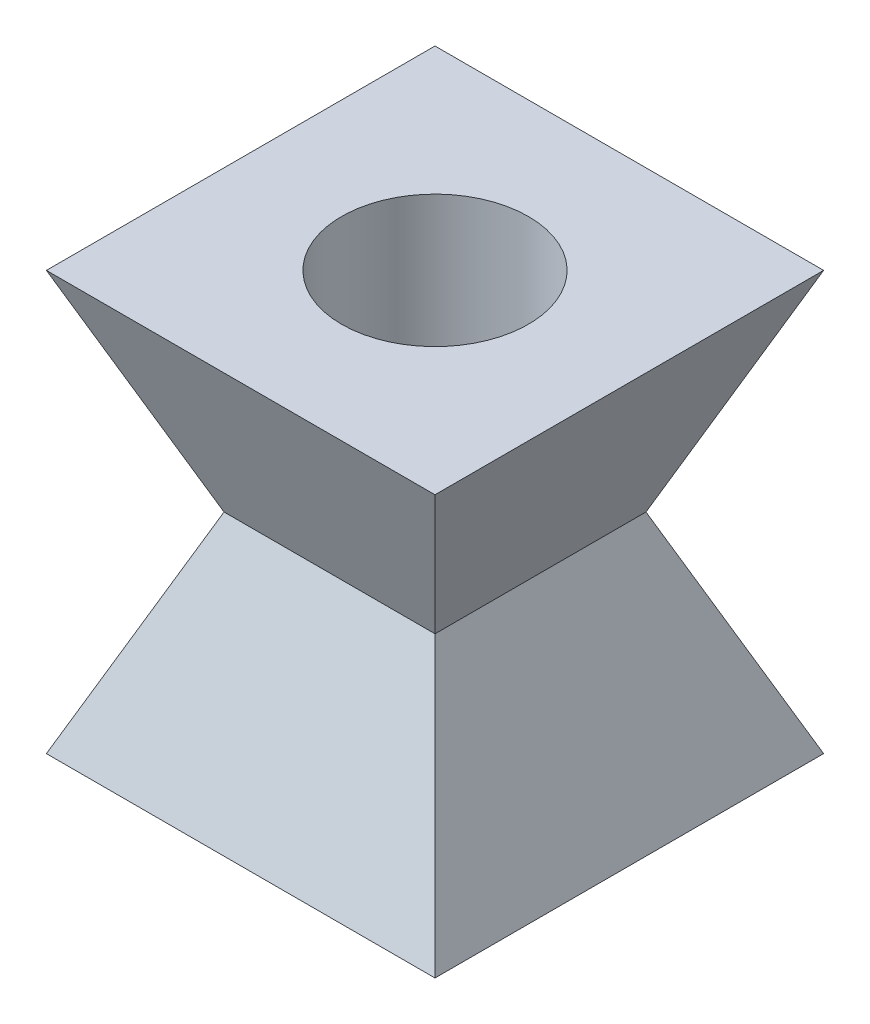
from build123d import *

# Parameters (mm, degrees)
BOSS_EXTRU_2_DEPTH           = 52
ESQUISSE3_R                  = 25
ENL_V_MAT_EXTRU_1_DEPTH      = 134.985073796
ENL_V_MAT_EXTRU_2_DEPTH      = 93.433760066
ENL_V_MAT_EXTRU_2_DEPTH_BACK = 93.433760066


with BuildPart() as part:
    # Esquisse2 → Boss.-Extru.2 (new, symmetric)
    with BuildSketch(Plane.XY):
        Polygon((28.229410292, 0), (52, -56), (-52, -56), (-28.229410292, 0), align=None)
        Polygon((-28.229410292, 0), (-52, 56), (52, 56), (28.229410292, 0), align=None)
    extrude(amount=BOSS_EXTRU_2_DEPTH, both=True)

    # Esquisse3 → Enlèv. mat.-Extru.1 (cut, through all)
    with BuildSketch(Plane(origin=(0, 56, 0), x_dir=(1, 0, 0), z_dir=(0, 1, 0))):
        with Locations(Location((0, 0, 0), (0, 0, 270))):
            Circle(ESQUISSE3_R)
    extrude(amount=-ENL_V_MAT_EXTRU_1_DEPTH, mode=Mode.SUBTRACT)

    # Esquisse4 → Enlèv. mat.-Extru.2 (cut, two sides: drawn at the far end of the back side and taken through both)
    with BuildSketch(Plane(origin=(0, 0, 0), x_dir=(0, 0, -1), z_dir=(1, 0, 0)).offset(-ENL_V_MAT_EXTRU_2_DEPTH_BACK)):
        Polygon((-28.229410292, 0), (-52, 56), (-52, 1.282618983), (-52, -56), align=None)
        Polygon((52, 56), (28.229410292, 0), (52, -56), align=None)
    extrude(amount=ENL_V_MAT_EXTRU_2_DEPTH + ENL_V_MAT_EXTRU_2_DEPTH_BACK, mode=Mode.SUBTRACT)


solid = part.part
